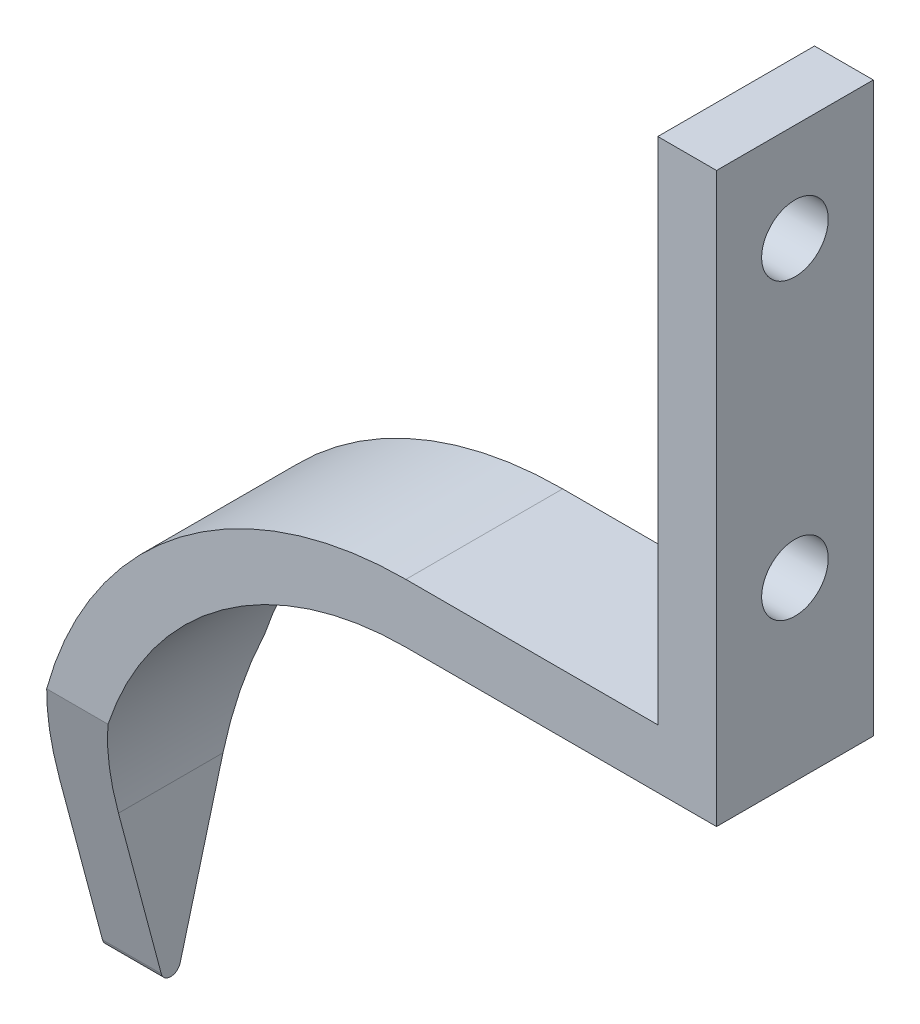
from build123d import *

# Parameters (mm, degrees)
BOSS_EXTRUDE1_DEPTH = 4
CUT_EXTRUDE1_DEPTH  = 106.97580396
FILLET1_R           = 0.5
SKETCH3_R           = 1.7
CUT_EXTRUDE2_DEPTH  = 106.027334656


with BuildPart() as part:
    # Sketch1 → Boss-Extrude1 (new, symmetric)
    with BuildSketch(Plane(origin=(0, 0, 0), x_dir=(-1, 0, 0), z_dir=(0, 0, -1))):
        with BuildLine():
            Line((59, 45), (59, 55))
            ThreePointArc((59, 55), (53.435028843, 68.435028843), (40, 74))
            Line((40, 74), (27.145, 74))
            Line((27.145, 74), (27.145, 100))
            Line((27.145, 100), (24.145, 100))
            Line((24.145, 100), (24.145, 71))
            Line((24.145, 71), (40, 71))
            ThreePointArc((40, 71), (51.313708499, 66.313708499), (56, 55))
            Line((56, 55), (56, 45))
            Line((56, 45), (59, 45))
        make_face()
    extrude(amount=BOSS_EXTRUDE1_DEPTH, both=True)

    # Sketch2 → Cut-Extrude1 (cut, through all)
    with BuildSketch(Plane.ZY.offset(59)):
        Polygon((-4, 45), (0, 45), (-2.666666667, 55), (-4, 55), align=None)
        Polygon((-2.666666667, 55), (-4, 60), (-4, 55), align=None)
        Polygon((4, 45), (4, 55), (2.666666667, 55), (0, 45), align=None)
        Polygon((2.666666667, 55), (4, 55), (4, 60), align=None)
    extrude(amount=-CUT_EXTRUDE1_DEPTH, mode=Mode.SUBTRACT)

    # Fillet1
    fillet1_edges = [part.edges().sort_by_distance(p)[0] for p in [
        (-57.5, 45, 0),
    ]]
    fillet(fillet1_edges, radius=FILLET1_R)

    # Sketch3 → Cut-Extrude2 (cut, through all)
    with BuildSketch(Plane.ZY.offset(27.145)):
        with Locations((0, 80)):
            Circle(SKETCH3_R)
        with Locations((0, 95)):
            Circle(SKETCH3_R)
    extrude(amount=-CUT_EXTRUDE2_DEPTH, mode=Mode.SUBTRACT)


solid = part.part
